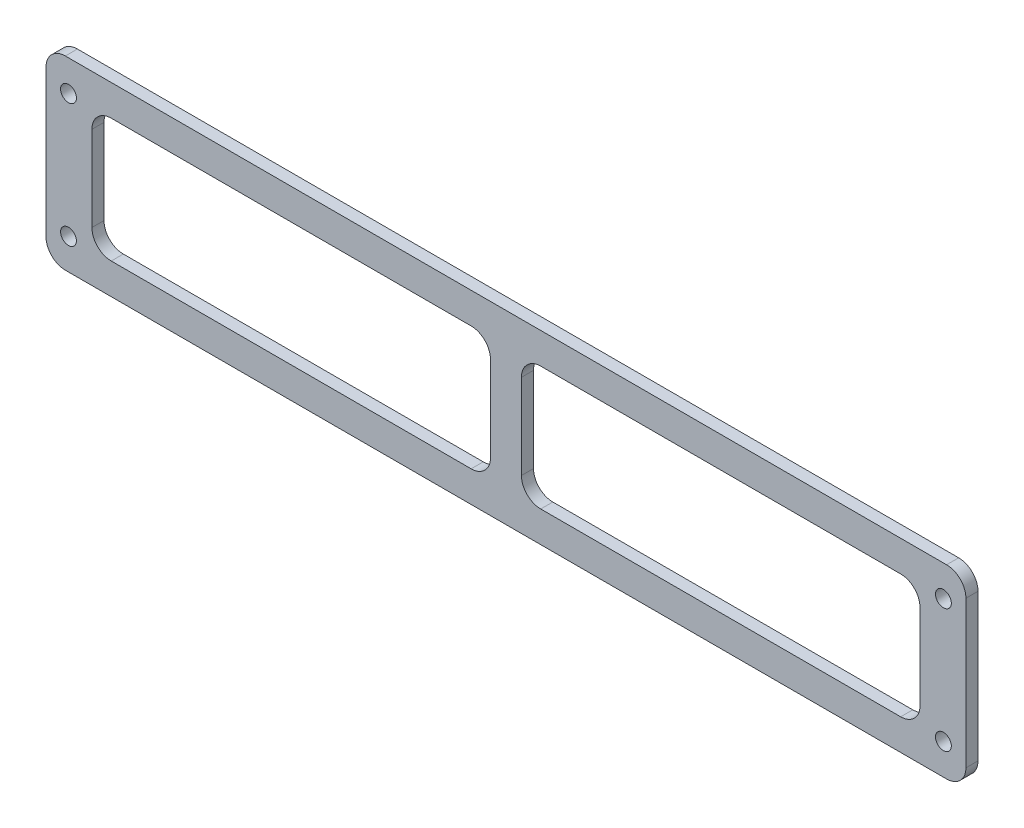
from build123d import *

# Parameters (mm, degrees)
SKETCH1_W           = 238
SKETCH1_H           = 48
SKETCH1_R           = 2.05
SKETCH1_W_2         = 103.125
SKETCH1_H_2         = 32
BOSS_EXTRUDE1_DEPTH = 3.125
FILLET1_R           = 5


with BuildPart() as part:
    # Sketch1 → Boss-Extrude1 (new body)
    with BuildSketch(Plane.XY):
        Rectangle(SKETCH1_W, SKETCH1_H)
        with Locations((-113.175, 16)):
            Circle(SKETCH1_R, mode=Mode.SUBTRACT)
        with Locations((-113.175, -16)):
            Circle(SKETCH1_R, mode=Mode.SUBTRACT)
        with Locations((113.175, 16)):
            Circle(SKETCH1_R, mode=Mode.SUBTRACT)
        with Locations((113.175, -16)):
            Circle(SKETCH1_R, mode=Mode.SUBTRACT)
        with Locations((-55.5625, 0)):
            Rectangle(SKETCH1_W_2, SKETCH1_H_2, mode=Mode.SUBTRACT)
        with Locations((55.5625, 0)):
            Rectangle(SKETCH1_W_2, SKETCH1_H_2, mode=Mode.SUBTRACT)
    extrude(amount=BOSS_EXTRUDE1_DEPTH)

    # Fillet1
    fillet1_edges = [part.edges().sort_by_distance(p)[0] for p in [
        (-107.125, 16, 1.5625),
        (-107.125, -16, 1.5625),
        (-4, -16, 1.5625),
        (-4, 16, 1.5625),
        (107.125, -16, 1.5625),
        (107.125, 16, 1.5625),
        (4, 16, 1.5625),
        (4, -16, 1.5625),
        (-119, 24, 1.5625),
        (119, 24, 1.5625),
        (119, -24, 1.5625),
        (-119, -24, 1.5625),
    ]]
    fillet(fillet1_edges, radius=FILLET1_R)


solid = part.part
